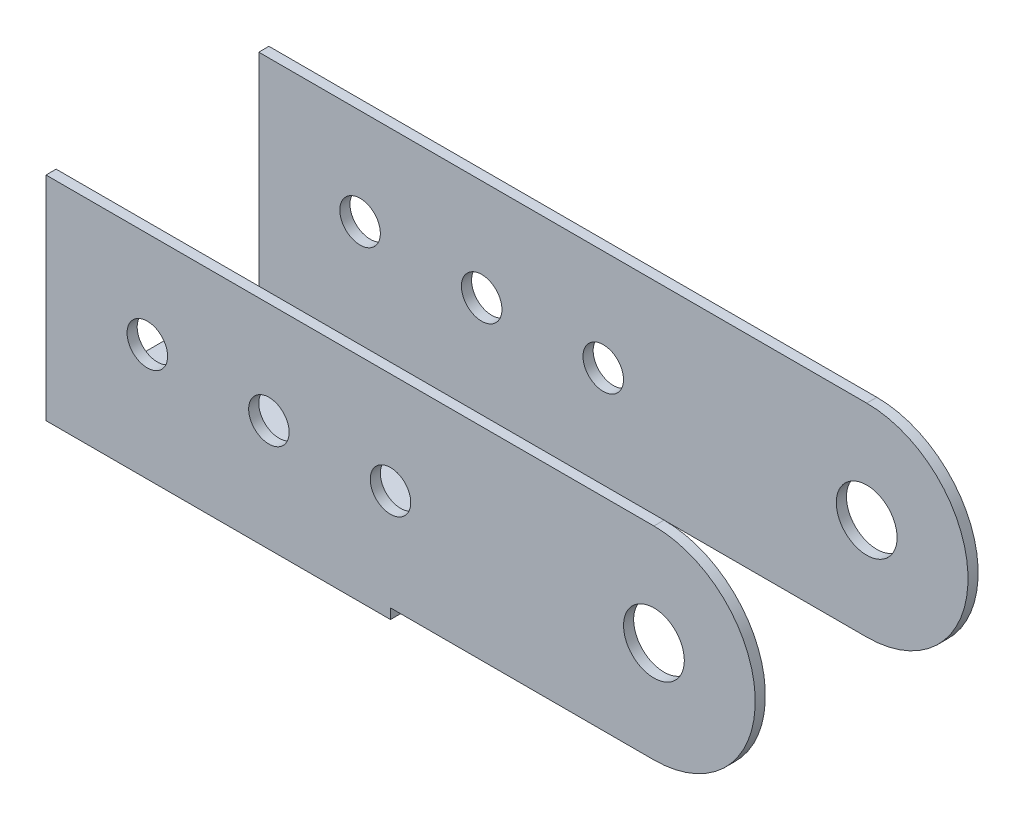
from build123d import *

# Parameters (mm, degrees)
SKETCH_2_R      = 1.5
SKETCH_2_R_2    = 1
EXTRUDE_1_DEPTH = 0.5
SKETCH_1_R      = 1.5
SKETCH_1_R_2    = 1
EXTRUDE_2_DEPTH = 0.5
SKETCH_3_W      = 17
SKETCH_3_H      = 11
EXTRUDE_3_DEPTH = 0.5


with BuildPart() as part:
    # 草图2 → 凸台-拉伸1 (new body)
    with BuildSketch(Plane.XY.offset(10)):
        with BuildLine():
            Line((15, 5), (-15, 5))
            Line((-15, 5), (-15, -5))
            Line((-15, -5), (15, -5))
            ThreePointArc((15, -5), (20, 0), (15, 5))
        make_face()
        with Locations((15, 0)):
            Circle(SKETCH_2_R, mode=Mode.SUBTRACT)
        with Locations((2, 0)):
            Circle(SKETCH_2_R_2, mode=Mode.SUBTRACT)
        with Locations((-4, 0)):
            Circle(SKETCH_2_R_2, mode=Mode.SUBTRACT)
        with Locations((-10, 0.253438211)):
            Circle(SKETCH_2_R_2, mode=Mode.SUBTRACT)
    extrude(amount=EXTRUDE_1_DEPTH)



with BuildPart() as body_2:
    # 草图1 → 凸台-拉伸2 (new body)
    with BuildSketch(Plane.XY):
        with BuildLine():
            Line((-15, 5), (15, 5))
            ThreePointArc((15, 5), (20, 0), (15, -5))
            Line((15, -5), (-15, -5))
            Line((-15, -5), (-15, 5))
        make_face()
        with Locations((15, 0)):
            Circle(SKETCH_1_R, mode=Mode.SUBTRACT)
        with Locations((-10, 0.253438211)):
            Circle(SKETCH_1_R_2, mode=Mode.SUBTRACT)
        with Locations((-4, 0)):
            Circle(SKETCH_1_R_2, mode=Mode.SUBTRACT)
        with Locations((2, 0)):
            Circle(SKETCH_1_R_2, mode=Mode.SUBTRACT)
    extrude(amount=-EXTRUDE_2_DEPTH)


with BuildPart() as part_1:
    add(part.part)

    add(body_2.part)  # 凸台-拉伸3 merges body 2
    # 草图3 → 凸台-拉伸3 (add)
    with BuildSketch(Plane(origin=(0, -5, 0), x_dir=(-1, 0, 0), z_dir=(0, -1, 0))):
        with Locations((6.5, -5)):
            Rectangle(SKETCH_3_W, SKETCH_3_H)
    extrude(amount=EXTRUDE_3_DEPTH)


solid = part_1.part
